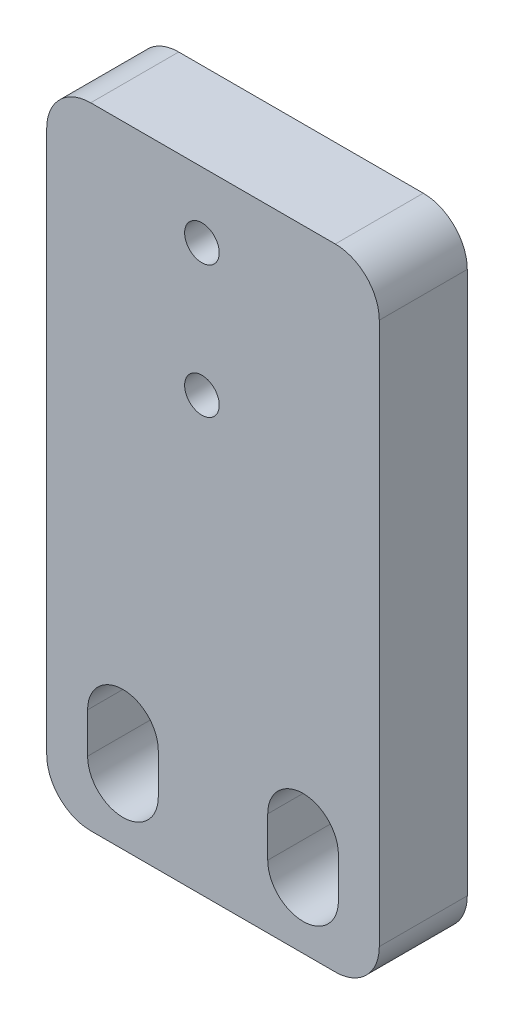
from build123d import *

# Parameters (mm, degrees)
SKETCH1_R           = 1.249999999
BOSS_EXTRUDE1_DEPTH = 6.35


with BuildPart() as part:
    # Sketch1 → Boss-Extrude1 (new body)
    with BuildSketch(Plane.XY):
        with BuildLine():
            Line((200.750613804, 258.978854223), (200.750613804, 219.828854223))
            ThreePointArc((200.750613804, 219.828854223), (201.680549774, 217.583790192), (203.925613804, 216.653854223))
            Line((203.925613804, 216.653854223), (221.575613802, 216.653854223))
            ThreePointArc((221.575613802, 216.653854223), (223.820677833, 217.583790192), (224.750613802, 219.828854223))
            Line((224.750613802, 219.828854223), (224.750613802, 258.978854223))
            ThreePointArc((224.750613802, 258.978854223), (223.820677833, 261.223918253), (221.575613802, 262.153854223))
            Line((221.575613802, 262.153854223), (203.925613804, 262.153854223))
            ThreePointArc((203.925613804, 262.153854223), (201.680549774, 261.223918253), (200.750613804, 258.978854223))
        make_face()
        with Locations((211.950613802, 247.891354224)):
            Circle(SKETCH1_R, mode=Mode.SUBTRACT)
        with Locations((211.950613802, 257.416354224)):
            Circle(SKETCH1_R, mode=Mode.SUBTRACT)
        with BuildLine():
            Line((203.700613802, 221.203854223), (203.700613802, 224.103854225))
            ThreePointArc((203.700613802, 224.103854225), (206.250613802, 226.653854225), (208.800613803, 224.103854225))
            Line((208.800613803, 224.103854225), (208.800613803, 221.203854223))
            ThreePointArc((208.800613803, 221.203854223), (206.250613802, 218.653854223), (203.700613802, 221.203854223))
        make_face(mode=Mode.SUBTRACT)
        with BuildLine():
            Line((216.700613804, 224.103854225), (216.700613804, 221.203854223))
            ThreePointArc((216.700613804, 221.203854223), (219.250613803, 218.653854224), (221.800613802, 221.203854223))
            Line((221.800613802, 221.203854223), (221.800613802, 224.103854225))
            ThreePointArc((221.800613802, 224.103854225), (219.250613803, 226.653854224), (216.700613804, 224.103854225))
        make_face(mode=Mode.SUBTRACT)
    extrude(amount=BOSS_EXTRUDE1_DEPTH)


solid = part.part
